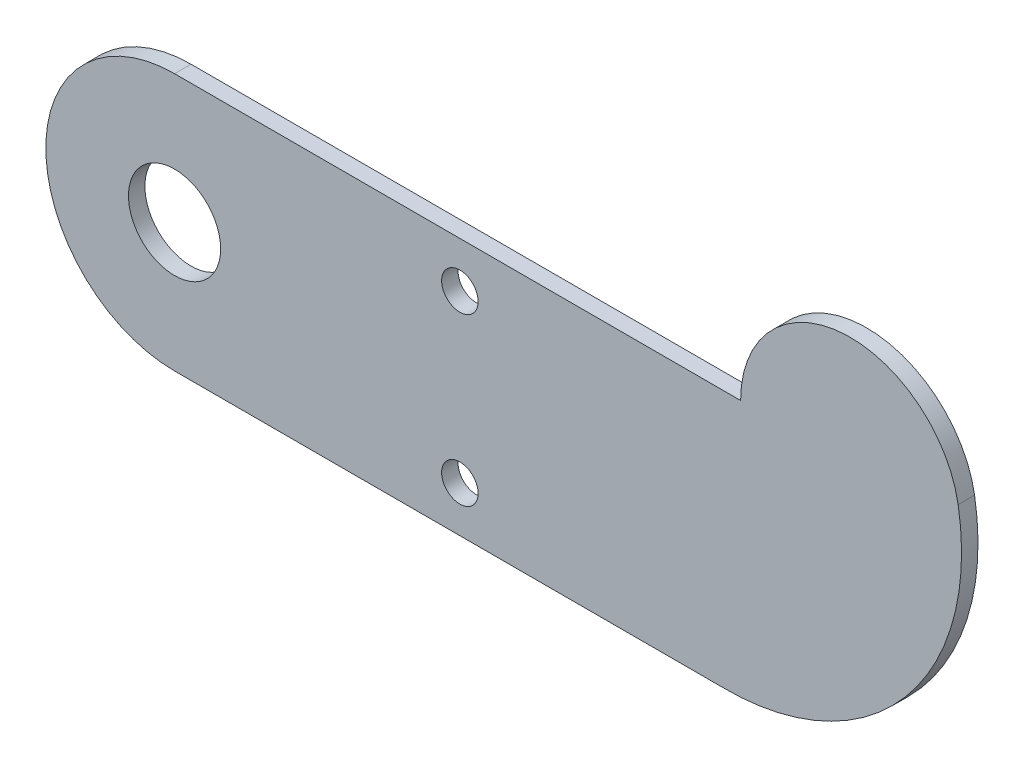
from build123d import *

# Parameters (mm, degrees)
ESBO_O1_R                = 5.05
ESBO_O1_R_2              = 2
RESSALTO_EXTRUS_O1_DEPTH = 1.8
ESBO_O2_R                = 5
RESSALTO_EXTRUS_O2_DEPTH = 1.8


with BuildPart() as part:
    # Esboço1 → Ressalto-extrusão1 (new body)
    with BuildSketch(Plane.XY):
        with BuildLine():
            Line((-12, 0), (-74, 0))
            ThreePointArc((-74, 0), (-88.1, -14.1), (-74, -28.2))
            Line((-74, -28.2), (-14, -28.2))
            ThreePointArc((-14, -28.2), (6.004940765, -19.140656488), (11.826301138, 2.034355278))
            ThreePointArc((11.826301138, 2.034355278), (-1.020878628, 11.956496428), (-12, 0))
        make_face()
        with Locations((-74, -14.1)):
            Circle(ESBO_O1_R, mode=Mode.SUBTRACT)
        with Locations((-42.75, -5)):
            Circle(ESBO_O1_R_2, mode=Mode.SUBTRACT)
        with Locations((-42.75, -23.2)):
            Circle(ESBO_O1_R_2, mode=Mode.SUBTRACT)
    extrude(amount=RESSALTO_EXTRUS_O1_DEPTH)

    # Esboço2 → Ressalto-extrusão2 (add)
    with BuildSketch(Plane.XY):
        Circle(ESBO_O2_R)
    extrude(amount=-RESSALTO_EXTRUS_O2_DEPTH)


solid = part.part
